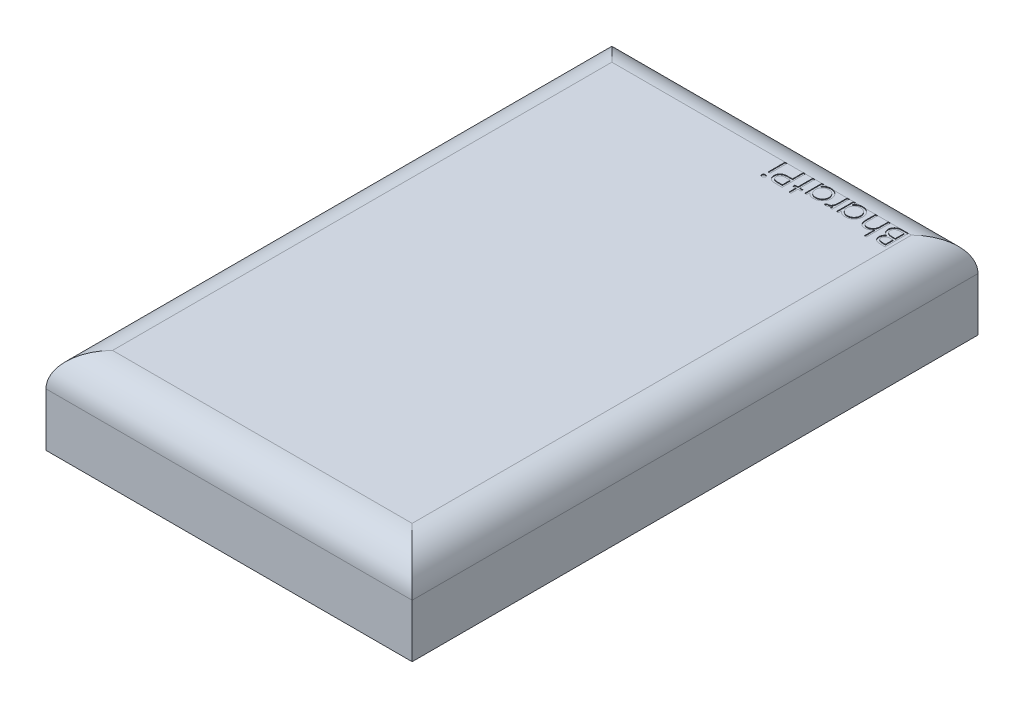
from build123d import *

# Parameters (mm, degrees)
SKETCH1_W           = 55
SKETCH1_H           = 85
BOSS_EXTRUDE1_DEPTH = 13
FILLET1_R           = 5
SKETCH2_W           = 0.314102564
SKETCH2_H           = 2.557692308
CUT_EXTRUDE1_DEPTH  = 0.1


with BuildPart() as part:
    # Sketch1 → Boss-Extrude1 (new body)
    with BuildSketch(Plane(origin=(0, 0, 0), x_dir=(1, 0, 0), z_dir=(0, 1, 0))):
        Rectangle(SKETCH1_W, SKETCH1_H)
    extrude(amount=BOSS_EXTRUDE1_DEPTH)

    # Fillet1
    fillet1_edges = [part.edges().sort_by_distance(p)[0] for p in [
        (-27.5, 13, 0),
        (0, 13, 42.5),
        (27.5, 13, 0),
        (0, 13, -42.5),
    ]]
    fillet(fillet1_edges, radius=FILLET1_R)

    # Sketch2 → Cut-Extrude1 (cut)
    # profile 1 of 9: a face of its own
    with BuildSketch(Plane(origin=(0, 13, 0), x_dir=(1, 0, 0), z_dir=(0, 1, 0))):
        with BuildLine():
            Line((22.051282051, 34), (21.368389423, 34))
            add(Edge.make_bspline(
                [(21.368389423, 34), (21.334960418, 34.000172984), (21.270166686, 34.000508269), (21.175954408, 34.005829002), (21.087680778, 34.012902413), (21.005501786, 34.02476768), (20.928882705, 34.037070397), (20.85860138, 34.05512784), (20.794069117, 34.075072944), (20.716579078, 34.105761192), (20.628656011, 34.153420429), (20.534155165, 34.224103607), (20.452009264, 34.308847029), (20.382160899, 34.405418843), (20.3261061, 34.511658782), (20.286065965, 34.625281059), (20.260342658, 34.744374116), (20.257730433, 34.826023418), (20.256410256, 34.86728766)],
                knots=[0, 0, 0, 0, 1.00128172, 1.940733171, 2.826250472, 3.653024905, 4.427672124, 5.149348099, 5.824709082, 6.450061444, 7.643590664, 8.808605388, 9.972104426, 11.165284501, 12.367876273, 13.557044126, 14.765369432, 16, 16, 16, 16], degree=3))
            add(Edge.make_bspline(
                [(20.256410256, 34.86728766), (20.257488595, 34.905945152), (20.259607633, 34.981910769), (20.280308915, 35.092646797), (20.311556998, 35.198389778), (20.356649879, 35.298120669), (20.414147093, 35.390963139), (20.484101093, 35.475333531), (20.567047364, 35.549575379), (20.629323882, 35.590892023), (20.660957532, 35.611879006)],
                knots=[0, 0, 0, 0, 1.044356178, 2.052258378, 3.035953355, 4.020338374, 5.002448483, 5.980768927, 6.974322109, 8, 8, 8, 8], degree=3))
            add(Edge.make_bspline(
                [(20.660957532, 35.611879006), (20.621194283, 35.627137161), (20.545117337, 35.656329791), (20.440290155, 35.708141918), (20.349943956, 35.764063583), (20.272914422, 35.824504675), (20.208369116, 35.891438768), (20.150869565, 35.963103107), (20.102071463, 36.041993518), (20.060435796, 36.126400483), (20.027453731, 36.215877014), (20.004559592, 36.30975372), (19.990040056, 36.406967318), (19.988141362, 36.473038748), (19.987179487, 36.506510417)],
                knots=[0, 0, 0, 0, 1.272200328, 2.434034374, 3.488177493, 4.442517805, 5.351202203, 6.260825393, 7.183200622, 8.11705787, 9.069326169, 10.026320267, 11.000137371, 12, 12, 12, 12], degree=3))
            add(Edge.make_bspline(
                [(19.987179487, 36.506510417), (19.988156427, 36.540677232), (19.990078583, 36.607901398), (20.004257216, 36.706657345), (20.028271245, 36.801029308), (20.061324283, 36.891645467), (20.104410582, 36.977975111), (20.156463308, 37.060696694), (20.218937559, 37.138584271), (20.28928971, 37.212768085), (20.36778247, 37.280605978), (20.45427535, 37.338903633), (20.546551628, 37.389257714), (20.645874917, 37.429739572), (20.751540451, 37.461429461), (20.863572984, 37.483339798), (20.981908898, 37.498162279), (21.063119828, 37.499377032), (21.104767628, 37.5)],
                knots=[0, 0, 0, 0, 0.978522333, 1.925270105, 2.85076145, 3.763600118, 4.682725947, 5.609499657, 6.557784645, 7.537954401, 8.534920712, 9.522742111, 10.520247711, 11.5409147, 12.58930695, 13.675078472, 14.807699069, 16, 16, 16, 16], degree=3))
            Line((21.104767628, 37.5), (22.051282051, 37.5))
            Line((22.051282051, 37.5), (22.051282051, 34))
        make_face()
        with BuildLine():
            Line((21.737179487, 34.358974359), (21.737179487, 35.480769231))
            Line((21.737179487, 35.480769231), (21.526141827, 35.480769231))
            add(Edge.make_bspline(
                [(21.526141827, 35.480769231), (21.495292754, 35.480372636), (21.435686058, 35.479606334), (21.349136767, 35.477342054), (21.268999446, 35.471279619), (21.194997971, 35.464867583), (21.127628276, 35.454994401), (21.066665012, 35.442912271), (21.011559933, 35.430246421), (20.94804245, 35.408643943), (20.876002732, 35.37705194), (20.799744047, 35.326823143), (20.731107802, 35.268669055), (20.674486862, 35.199689219), (20.627347874, 35.125197235), (20.595611023, 35.044637613), (20.573482911, 34.96078646), (20.571512992, 34.902958368), (20.570512821, 34.873597756)],
                knots=[0, 0, 0, 0, 1.156584208, 2.234756387, 3.244705828, 4.168772894, 5.018724976, 5.795346628, 6.498686023, 7.135894168, 8.308330183, 9.43588092, 10.547699294, 11.667188675, 12.76860303, 13.837480448, 14.902040606, 16, 16, 16, 16], degree=3))
            add(Edge.make_bspline(
                [(20.570512821, 34.873597756), (20.57100062, 34.854160391), (20.571957493, 34.816031875), (20.580978311, 34.760480817), (20.593426932, 34.707618164), (20.613957809, 34.658868998), (20.638281591, 34.612521538), (20.66945887, 34.570039811), (20.705409142, 34.530272982), (20.747322652, 34.494286964), (20.795028068, 34.461739688), (20.850036584, 34.434645635), (20.910852653, 34.41056748), (20.97874448, 34.392315675), (21.052359721, 34.376470202), (21.132821484, 34.366478135), (21.219644851, 34.360059073), (21.279801452, 34.359343995), (21.310897436, 34.358974359)],
                knots=[0, 0, 0, 0, 0.911412742, 1.787835618, 2.63643285, 3.453173233, 4.262886967, 5.08783453, 5.918594724, 6.773969545, 7.67442701, 8.62112486, 9.645634318, 10.739428598, 11.916091468, 13.177237585, 14.540865421, 16, 16, 16, 16], degree=3))
            Line((21.310897436, 34.358974359), (21.737179487, 34.358974359))
        make_face(mode=Mode.SUBTRACT)
        with BuildLine():
            Line((21.737179487, 35.83974359), (21.737179487, 37.141025641))
            Line((21.737179487, 37.141025641), (21.289863782, 37.141025641))
            add(Edge.make_bspline(
                [(21.289863782, 37.141025641), (21.257848057, 37.140604993), (21.196141968, 37.139794251), (21.106981197, 37.13787047), (21.02478179, 37.130733251), (20.948859351, 37.123890525), (20.879565166, 37.112711512), (20.816225231, 37.10188637), (20.760286259, 37.085956638), (20.69483443, 37.064037046), (20.621627218, 37.029006631), (20.541681488, 36.977491407), (20.47126593, 36.914742066), (20.411523263, 36.842489763), (20.361849855, 36.764740239), (20.327485667, 36.681340468), (20.305219629, 36.595076139), (20.302597219, 36.536091755), (20.301282051, 36.506510417)],
                knots=[0, 0, 0, 0, 1.16016216, 2.236059617, 3.229676189, 4.14889023, 4.996733752, 5.772278665, 6.474820656, 7.101410824, 8.271817372, 9.403828207, 10.537358096, 11.673541442, 12.791884111, 13.865947414, 14.929748409, 16, 16, 16, 16], degree=3))
            add(Edge.make_bspline(
                [(20.301282051, 36.506510417), (20.301550517, 36.488014302), (20.302083119, 36.451320418), (20.310455091, 36.397445038), (20.322073246, 36.344998886), (20.339195144, 36.294694354), (20.359907985, 36.245665208), (20.387233498, 36.199506765), (20.418056476, 36.154254134), (20.465796606, 36.096371008), (20.536181938, 36.030484909), (20.636237171, 35.966784366), (20.749367359, 35.914579785), (20.831612726, 35.892510301), (20.874098558, 35.881109776)],
                knots=[0, 0, 0, 0, 0.723354195, 1.435040621, 2.129761981, 2.824182007, 3.512608497, 4.209435533, 4.920062464, 5.654614313, 7.143585817, 8.671381114, 10.280521501, 12, 12, 12, 12], degree=3))
            add(Edge.make_bspline(
                [(20.874098558, 35.881109776), (20.891127638, 35.877654459), (20.928050196, 35.870162621), (20.988258082, 35.862259384), (21.057224435, 35.855169923), (21.134654481, 35.85006353), (21.220856169, 35.844581907), (21.315801805, 35.842525963), (21.419558513, 35.840016576), (21.491550974, 35.839836913), (21.528946314, 35.83974359)],
                knots=[0, 0, 0, 0, 0.634452549, 1.375623993, 2.216454381, 3.166361212, 4.209414599, 5.370755378, 6.634280627, 8, 8, 8, 8], degree=3))
            Line((21.528946314, 35.83974359), (21.737179487, 35.83974359))
        make_face(mode=Mode.SUBTRACT)
    # profile 2 of 9: a face of its own
    with BuildSketch(Plane(origin=(0, 13, 0), x_dir=(1, 0, 0), z_dir=(0, 1, 0))):
        with BuildLine():
            Line((19.358974359, 33.91025641), (19.044871795, 33.91025641))
            Line((19.044871795, 33.91025641), (19.044871795, 35.425380609))
            add(Edge.make_bspline(
                [(19.044871795, 35.425380609), (19.011100806, 35.383295228), (18.945451296, 35.301482855), (18.835705424, 35.193583739), (18.721349423, 35.101679352), (18.601412826, 35.026630609), (18.476405369, 34.968411013), (18.346019877, 34.92768025), (18.210588758, 34.90228145), (18.118333258, 34.899062498), (18.071714744, 34.897435897)],
                knots=[0, 0, 0, 0, 1.12556596, 2.18805719, 3.205172764, 4.182516927, 5.13416184, 6.075333115, 7.027428072, 8, 8, 8, 8], degree=3))
            add(Edge.make_bspline(
                [(18.071714744, 34.897435897), (18.024361523, 34.899082507), (17.931633388, 34.902306936), (17.797107583, 34.930718234), (17.670585355, 34.975679603), (17.553756791, 35.038869491), (17.448425874, 35.117327732), (17.35706834, 35.209345734), (17.280429488, 35.313711535), (17.229152417, 35.410992645), (17.195545328, 35.497503689), (17.174301412, 35.571746709), (17.156279797, 35.654466634), (17.140580803, 35.745631977), (17.130116996, 35.845676962), (17.121712445, 35.954151272), (17.115735971, 36.071048374), (17.11550437, 36.151968626), (17.115384615, 36.193810096)],
                knots=[0, 0, 0, 0, 1.235689485, 2.419754739, 3.574485241, 4.732583367, 5.875375667, 6.993392835, 8.106934443, 9.24564317, 9.854426656, 10.528623913, 11.260290605, 12.06517837, 12.94359002, 13.886555271, 14.907200199, 16, 16, 16, 16], degree=3))
            Line((17.115384615, 36.193810096), (17.115384615, 37.5))
            Line((17.115384615, 37.5), (17.429487179, 37.5))
            Line((17.429487179, 37.5), (17.429487179, 36.296875))
            add(Edge.make_bspline(
                [(17.429487179, 36.296875), (17.429676722, 36.262052286), (17.430039284, 36.19544236), (17.431252502, 36.100076832), (17.43389919, 36.013812076), (17.43833423, 35.936469018), (17.442796917, 35.868152476), (17.449123843, 35.808750862), (17.456430132, 35.758636821), (17.462999336, 35.728472221), (17.465945513, 35.71494391)],
                knots=[0, 0, 0, 0, 1.430934443, 2.737134061, 3.918973087, 4.976914145, 5.92044225, 6.731742364, 7.431207999, 8, 8, 8, 8], degree=3))
            add(Edge.make_bspline(
                [(17.465945513, 35.71494391), (17.47731672, 35.675220507), (17.499120044, 35.59905425), (17.550810245, 35.495777861), (17.613868602, 35.406925297), (17.692028761, 35.335020237), (17.782694211, 35.278363459), (17.886725701, 35.239763165), (18.002793898, 35.215147337), (18.084432465, 35.212777257), (18.127103365, 35.211538462)],
                knots=[0, 0, 0, 0, 1.090171874, 2.090312098, 3.036871164, 3.954896932, 4.878889889, 5.844924892, 6.87358393, 8, 8, 8, 8], degree=3))
            add(Edge.make_bspline(
                [(18.127103365, 35.211538462), (18.152373385, 35.212007439), (18.202382101, 35.212935532), (18.27649801, 35.222489301), (18.348617161, 35.23757819), (18.418545988, 35.259865822), (18.486427137, 35.28696337), (18.552536538, 35.320217481), (18.615969442, 35.360425281), (18.677544584, 35.40567876), (18.734864987, 35.455741071), (18.78819136, 35.508589954), (18.835729894, 35.564864414), (18.878798434, 35.623664663), (18.915976733, 35.685796421), (18.948429811, 35.750660749), (18.975965509, 35.818342892), (18.989648201, 35.865317954), (18.996494391, 35.888822115)],
                knots=[0, 0, 0, 0, 1.024369801, 2.02720137, 3.025498567, 4.008789058, 4.999724648, 5.987391013, 7.005161842, 8.042127274, 9.083588116, 10.088924978, 11.084112559, 12.068088063, 13.041783903, 14.016724555, 15.007660144, 16, 16, 16, 16], degree=3))
            add(Edge.make_bspline(
                [(18.996494391, 35.888822115), (19.000433818, 35.905843066), (19.009018315, 35.942933813), (19.018333148, 36.004108137), (19.026670945, 36.075194509), (19.033719495, 36.15608511), (19.038042581, 36.247076352), (19.042700822, 36.347547311), (19.044434836, 36.458127332), (19.044721789, 36.535022839), (19.044871795, 36.575220353)],
                knots=[0, 0, 0, 0, 0.607992626, 1.324890765, 2.152360218, 3.099583803, 4.150613268, 5.323148443, 6.60066238, 8, 8, 8, 8], degree=3))
            Line((19.044871795, 36.575220353), (19.044871795, 37.5))
            Line((19.044871795, 37.5), (19.358974359, 37.5))
            Line((19.358974359, 37.5), (19.358974359, 33.91025641))
        make_face()
    # profile 3 of 9: a face of its own
    with BuildSketch(Plane(origin=(0, 13, 0), x_dir=(1, 0, 0), z_dir=(0, 1, 0))):
        with BuildLine():
            Line((13.794871795, 34.942307692), (13.794871795, 37.5))
            Line((13.794871795, 37.5), (14.108974359, 37.5))
            Line((14.108974359, 37.5), (14.108974359, 37.057592147))
            add(Edge.make_bspline(
                [(14.108974359, 37.057592147), (14.144441134, 37.097576535), (14.21375792, 37.175722609), (14.328421015, 37.278443761), (14.450967955, 37.362310526), (14.579310924, 37.430385343), (14.714443339, 37.481701428), (14.855571575, 37.517852974), (15.002585209, 37.541370069), (15.10284054, 37.543694081), (15.153645833, 37.544871795)],
                knots=[0, 0, 0, 0, 1.074235403, 2.099501444, 3.086304576, 4.053325556, 5.01427503, 5.985443889, 6.979105517, 8, 8, 8, 8], degree=3))
            add(Edge.make_bspline(
                [(15.153645833, 37.544871795), (15.19881391, 37.543645626), (15.287887357, 37.541227567), (15.418914669, 37.522462337), (15.545013436, 37.492342521), (15.666264022, 37.450401861), (15.781844855, 37.39505608), (15.892407204, 37.328080041), (15.9982091, 37.24910346), (16.097238413, 37.158464824), (16.188545893, 37.060122499), (16.268430717, 36.954926059), (16.336135705, 36.844320376), (16.39177708, 36.728336536), (16.434835294, 36.607059323), (16.46479216, 36.480571936), (16.483537168, 36.349084842), (16.485954002, 36.259544937), (16.487179487, 36.214142628)],
                knots=[0, 0, 0, 0, 1.034036272, 2.039165313, 3.024406509, 3.999331371, 4.971254918, 5.953351348, 6.95522652, 7.989525907, 9.023492927, 10.024309745, 11.009187477, 11.988246066, 12.964946762, 13.950187958, 14.960617622, 16, 16, 16, 16], degree=3))
            add(Edge.make_bspline(
                [(16.487179487, 36.214142628), (16.485926821, 36.169678735), (16.483450368, 36.081776017), (16.464992737, 35.952500058), (16.433978011, 35.827971686), (16.390369842, 35.708652201), (16.334698879, 35.594061063), (16.265829518, 35.485094836), (16.185973481, 35.380086643), (16.093690154, 35.28240391), (15.993772017, 35.192500637), (15.88737817, 35.113332127), (15.775835238, 35.046527808), (15.658919561, 34.992222391), (15.537459007, 34.949068002), (15.410530904, 34.918985237), (15.278712469, 34.901301387), (15.189222918, 34.898736774), (15.143830128, 34.897435897)],
                knots=[0, 0, 0, 0, 1.02050356, 2.017480486, 2.990790918, 3.96161403, 4.928589988, 5.909588639, 6.91611943, 7.952353252, 8.989586576, 9.99823133, 10.991940466, 11.968822692, 12.952985106, 13.945868367, 14.958059758, 16, 16, 16, 16], degree=3))
            add(Edge.make_bspline(
                [(15.143830128, 34.897435897), (15.091629228, 34.898868251), (14.989265725, 34.901677028), (14.839329316, 34.925251159), (14.697422446, 34.964709238), (14.562315982, 35.018565451), (14.435908605, 35.091090603), (14.31698511, 35.180828566), (14.206956568, 35.289954882), (14.142200082, 35.372970602), (14.108974359, 35.415564904)],
                knots=[0, 0, 0, 0, 1.038908319, 2.037250181, 3.012632028, 3.966567879, 4.9252131, 5.905168122, 6.925168603, 8, 8, 8, 8], degree=3))
            Line((14.108974359, 35.415564904), (14.108974359, 34.942307692))
            Line((14.108974359, 34.942307692), (13.794871795, 34.942307692))
        make_face()
        with BuildLine():
            add(Edge.make_bspline(
                [(15.139623397, 35.211538462), (15.185536775, 35.21317348), (15.276162479, 35.216400746), (15.409220371, 35.241554277), (15.53648159, 35.283513891), (15.657739186, 35.340567823), (15.769645456, 35.413652149), (15.871317506, 35.499824237), (15.959999181, 35.600139859), (16.034982032, 35.712294248), (16.097231696, 35.831808374), (16.140188798, 35.957653128), (16.1687211, 36.08642718), (16.171621202, 36.173793995), (16.173076923, 36.217648237)],
                knots=[0, 0, 0, 0, 1.031179624, 2.035384561, 3.030098214, 4.035455833, 5.037557836, 6.024646278, 7.02156144, 8.035264006, 9.049836703, 10.039645228, 11.015989397, 12, 12, 12, 12], degree=3))
            add(Edge.make_bspline(
                [(16.173076923, 36.217648237), (16.171187217, 36.261229683), (16.167415212, 36.348221751), (16.141065352, 36.477193145), (16.094813711, 36.60221686), (16.033925733, 36.72327158), (15.957762555, 36.836262519), (15.869255912, 36.938430416), (15.767067957, 37.025930843), (15.654176284, 37.099221738), (15.533729888, 37.158178374), (15.407021183, 37.199760676), (15.276258663, 37.226015378), (15.187188202, 37.229179283), (15.142427885, 37.230769231)],
                knots=[0, 0, 0, 0, 0.979235476, 1.954632679, 2.943119654, 3.967171814, 4.992637064, 5.997548408, 6.995574264, 8.005058949, 9.015076297, 9.999929117, 10.994910263, 12, 12, 12, 12], degree=3))
            add(Edge.make_bspline(
                [(15.142427885, 37.230769231), (15.096982105, 37.229115056), (15.006824838, 37.225833434), (14.87330687, 37.200506432), (14.743974486, 37.15802581), (14.619880953, 37.10017975), (14.504473715, 37.028464705), (14.401375967, 36.944134227), (14.312309429, 36.847560067), (14.238977813, 36.739319282), (14.180386842, 36.621963885), (14.138899991, 36.496616927), (14.113702338, 36.364023263), (14.110572143, 36.273148935), (14.108974359, 36.226762821)],
                knots=[0, 0, 0, 0, 1.017730373, 2.019016736, 3.032373701, 4.060729657, 5.079187105, 6.068726676, 7.03591854, 8.011858086, 8.988317194, 9.965225429, 10.961364673, 12, 12, 12, 12], degree=3))
            add(Edge.make_bspline(
                [(14.108974359, 36.226762821), (14.109934031, 36.191425004), (14.111822968, 36.121868997), (14.126253321, 36.019741285), (14.14920904, 35.922008272), (14.181552323, 35.828562987), (14.224054343, 35.739937624), (14.275261648, 35.655437485), (14.336224576, 35.575849676), (14.40508787, 35.501274987), (14.4813149, 35.433595644), (14.562372468, 35.373943638), (14.648056633, 35.323461627), (14.738307249, 35.283062813), (14.8324292, 35.250150913), (14.931324628, 35.228413172), (15.033996847, 35.213439223), (15.104043835, 35.21217872), (15.139623397, 35.211538462)],
                knots=[0, 0, 0, 0, 1.050062701, 2.066855696, 3.059271411, 4.030305351, 4.999747758, 5.975466543, 6.961907836, 7.974539719, 8.98812422, 9.98710676, 10.961662635, 11.93785114, 12.922015094, 13.919620009, 14.94329489, 16, 16, 16, 16], degree=3))
        make_face(mode=Mode.SUBTRACT)
    # profile 4 of 9: a face of its own
    with BuildSketch(Plane(origin=(0, 13, 0), x_dir=(1, 0, 0), z_dir=(0, 1, 0))):
        with BuildLine():
            Line((13.166666667, 34.942307692), (12.852564103, 34.942307692))
            Line((12.852564103, 34.942307692), (12.852564103, 35.318810096))
            add(Edge.make_bspline(
                [(12.852564103, 35.318810096), (12.829392961, 35.283734911), (12.785078334, 35.216653893), (12.711032389, 35.128110867), (12.636019001, 35.053633499), (12.557486281, 34.995704945), (12.477431342, 34.951561399), (12.396091008, 34.92027648), (12.31287827, 34.901207266), (12.256707541, 34.898694704), (12.228565705, 34.897435897)],
                knots=[0, 0, 0, 0, 1.280240866, 2.448450709, 3.511242029, 4.49418232, 5.41222037, 6.289222348, 7.142891256, 8, 8, 8, 8], degree=3))
            add(Edge.make_bspline(
                [(12.228565705, 34.897435897), (12.206732307, 34.89859979), (12.162036073, 34.900982453), (12.094169958, 34.918560852), (12.023958744, 34.945560824), (11.978650047, 34.97157234), (11.955128205, 34.985076122)],
                knots=[0, 0, 0, 0, 0.90119973, 1.844890732, 2.881183062, 4, 4, 4, 4], degree=3))
            Line((11.955128205, 34.985076122), (12.127604167, 35.257111378))
            add(Edge.make_bspline(
                [(12.127604167, 35.257111378), (12.142713188, 35.250371112), (12.171393002, 35.237576797), (12.213347569, 35.222434787), (12.252028905, 35.213518871), (12.276672464, 35.212168153), (12.288161058, 35.211538462)],
                knots=[0, 0, 0, 0, 1.180555205, 2.24091978, 3.179933427, 4, 4, 4, 4], degree=3))
            add(Edge.make_bspline(
                [(12.288161058, 35.211538462), (12.313627648, 35.213143427), (12.365108147, 35.216387851), (12.440328419, 35.24410812), (12.514296002, 35.285769922), (12.571741098, 35.334913432), (12.616716674, 35.381220018), (12.649082538, 35.421969567), (12.678150705, 35.46805415), (12.70634171, 35.517728177), (12.732534926, 35.57222795), (12.755941949, 35.631645363), (12.777832161, 35.695488907), (12.790159697, 35.739880847), (12.796474359, 35.762620192)],
                knots=[0, 0, 0, 0, 1.1355652, 2.295535532, 3.545064593, 4.917862323, 5.656949634, 6.430545574, 7.239270929, 8.090880714, 8.983622437, 9.940313733, 10.94494545, 12, 12, 12, 12], degree=3))
            add(Edge.make_bspline(
                [(12.796474359, 35.762620192), (12.801214931, 35.782896243), (12.811767593, 35.828031366), (12.821753985, 35.903408766), (12.832018369, 35.992407393), (12.839027909, 36.095130637), (12.845649355, 36.211973369), (12.849307315, 36.342431528), (12.852447719, 36.486863682), (12.85252407, 36.587604542), (12.852564103, 36.640424679)],
                knots=[0, 0, 0, 0, 0.566841273, 1.261806378, 2.068780918, 3.007109044, 4.065315289, 5.256255371, 6.561408263, 8, 8, 8, 8], degree=3))
            Line((12.852564103, 36.640424679), (12.852564103, 37.5))
            Line((12.852564103, 37.5), (13.166666667, 37.5))
            Line((13.166666667, 37.5), (13.166666667, 34.942307692))
        make_face()
    # profile 5 of 9: a face of its own
    with BuildSketch(Plane(origin=(0, 13, 0), x_dir=(1, 0, 0), z_dir=(0, 1, 0))):
        with BuildLine():
            Line((9.038461538, 34.942307692), (9.038461538, 37.5))
            Line((9.038461538, 37.5), (9.352564103, 37.5))
            Line((9.352564103, 37.5), (9.352564103, 37.057592147))
            add(Edge.make_bspline(
                [(9.352564103, 37.057592147), (9.388030878, 37.097576535), (9.457347664, 37.175722609), (9.572010759, 37.278443761), (9.694557699, 37.362310526), (9.822900667, 37.430385343), (9.958033083, 37.481701428), (10.099161319, 37.517852974), (10.246174953, 37.541370069), (10.346430284, 37.543694081), (10.397235577, 37.544871795)],
                knots=[0, 0, 0, 0, 1.074235403, 2.099501444, 3.086304576, 4.053325556, 5.01427503, 5.985443889, 6.979105517, 8, 8, 8, 8], degree=3))
            add(Edge.make_bspline(
                [(10.397235577, 37.544871795), (10.442403654, 37.543645626), (10.5314771, 37.541227567), (10.662504413, 37.522462337), (10.788603179, 37.492342521), (10.909853765, 37.450401861), (11.025434599, 37.39505608), (11.135996947, 37.328080041), (11.241798843, 37.24910346), (11.340828156, 37.158464824), (11.432135637, 37.060122499), (11.51202046, 36.954926059), (11.579725449, 36.844320376), (11.635366824, 36.728336536), (11.678425037, 36.607059323), (11.708381903, 36.480571936), (11.727126911, 36.349084842), (11.729543745, 36.259544937), (11.730769231, 36.214142628)],
                knots=[0, 0, 0, 0, 1.034036272, 2.039165313, 3.024406509, 3.999331371, 4.971254918, 5.953351348, 6.95522652, 7.989525907, 9.023492927, 10.024309745, 11.009187477, 11.988246066, 12.964946762, 13.950187958, 14.960617622, 16, 16, 16, 16], degree=3))
            add(Edge.make_bspline(
                [(11.730769231, 36.214142628), (11.729516565, 36.169678735), (11.727040111, 36.081776017), (11.708582481, 35.952500058), (11.677567755, 35.827971686), (11.633959586, 35.708652201), (11.578288623, 35.594061063), (11.509419261, 35.485094836), (11.429563225, 35.380086643), (11.337279898, 35.28240391), (11.237361761, 35.192500637), (11.130967914, 35.113332127), (11.019424981, 35.046527808), (10.902509305, 34.992222391), (10.781048751, 34.949068002), (10.654120647, 34.918985237), (10.522302213, 34.901301387), (10.432812661, 34.898736774), (10.387419872, 34.897435897)],
                knots=[0, 0, 0, 0, 1.02050356, 2.017480486, 2.990790918, 3.96161403, 4.928589988, 5.909588639, 6.91611943, 7.952353252, 8.989586576, 9.99823133, 10.991940466, 11.968822692, 12.952985106, 13.945868367, 14.958059758, 16, 16, 16, 16], degree=3))
            add(Edge.make_bspline(
                [(10.387419872, 34.897435897), (10.335218971, 34.898868251), (10.232855469, 34.901677028), (10.08291906, 34.925251159), (9.94101219, 34.964709238), (9.805905725, 35.018565451), (9.679498348, 35.091090603), (9.560574854, 35.180828566), (9.450546311, 35.289954882), (9.385789826, 35.372970602), (9.352564103, 35.415564904)],
                knots=[0, 0, 0, 0, 1.038908319, 2.037250181, 3.012632028, 3.966567879, 4.9252131, 5.905168122, 6.925168603, 8, 8, 8, 8], degree=3))
            Line((9.352564103, 35.415564904), (9.352564103, 34.942307692))
            Line((9.352564103, 34.942307692), (9.038461538, 34.942307692))
        make_face()
        with BuildLine():
            add(Edge.make_bspline(
                [(10.383213141, 35.211538462), (10.429126518, 35.21317348), (10.519752223, 35.216400746), (10.652810115, 35.241554277), (10.780071334, 35.283513891), (10.90132893, 35.340567823), (11.0132352, 35.413652149), (11.11490725, 35.499824237), (11.203588925, 35.600139859), (11.278571776, 35.712294248), (11.340821439, 35.831808374), (11.383778542, 35.957653128), (11.412310844, 36.08642718), (11.415210945, 36.173793995), (11.416666667, 36.217648237)],
                knots=[0, 0, 0, 0, 1.031179624, 2.035384561, 3.030098214, 4.035455833, 5.037557836, 6.024646278, 7.02156144, 8.035264006, 9.049836703, 10.039645228, 11.015989397, 12, 12, 12, 12], degree=3))
            add(Edge.make_bspline(
                [(11.416666667, 36.217648237), (11.414776961, 36.261229683), (11.411004956, 36.348221751), (11.384655096, 36.477193145), (11.338403455, 36.60221686), (11.277515476, 36.72327158), (11.201352298, 36.836262519), (11.112845655, 36.938430416), (11.010657701, 37.025930843), (10.897766028, 37.099221738), (10.777319631, 37.158178374), (10.650610927, 37.199760676), (10.519848407, 37.226015378), (10.430777945, 37.229179283), (10.386017628, 37.230769231)],
                knots=[0, 0, 0, 0, 0.979235476, 1.954632679, 2.943119654, 3.967171814, 4.992637064, 5.997548408, 6.995574264, 8.005058949, 9.015076297, 9.999929117, 10.994910263, 12, 12, 12, 12], degree=3))
            add(Edge.make_bspline(
                [(10.386017628, 37.230769231), (10.340571849, 37.229115056), (10.250414582, 37.225833434), (10.116896613, 37.200506432), (9.98756423, 37.15802581), (9.863470697, 37.10017975), (9.748063459, 37.028464705), (9.644965711, 36.944134227), (9.555899172, 36.847560067), (9.482567556, 36.739319282), (9.423976586, 36.621963885), (9.382489734, 36.496616927), (9.357292082, 36.364023263), (9.354161887, 36.273148935), (9.352564103, 36.226762821)],
                knots=[0, 0, 0, 0, 1.017730373, 2.019016736, 3.032373701, 4.060729657, 5.079187105, 6.068726676, 7.03591854, 8.011858086, 8.988317194, 9.965225429, 10.961364673, 12, 12, 12, 12], degree=3))
            add(Edge.make_bspline(
                [(9.352564103, 36.226762821), (9.353523774, 36.191425004), (9.355412711, 36.121868997), (9.369843064, 36.019741285), (9.392798784, 35.922008272), (9.425142067, 35.828562987), (9.467644087, 35.739937624), (9.518851392, 35.655437485), (9.57981432, 35.575849676), (9.648677613, 35.501274987), (9.724904644, 35.433595644), (9.805962211, 35.373943638), (9.891646376, 35.323461627), (9.981896993, 35.283062813), (10.076018944, 35.250150913), (10.174914372, 35.228413172), (10.277586591, 35.213439223), (10.347633579, 35.21217872), (10.383213141, 35.211538462)],
                knots=[0, 0, 0, 0, 1.050062701, 2.066855696, 3.059271411, 4.030305351, 4.999747758, 5.975466543, 6.961907836, 7.974539719, 8.98812422, 9.98710676, 10.961662635, 11.93785114, 12.922015094, 13.919620009, 14.94329489, 16, 16, 16, 16], degree=3))
        make_face(mode=Mode.SUBTRACT)
    # profile 6 of 9: a face of its own
    with BuildSketch(Plane(origin=(0, 13, 0), x_dir=(1, 0, 0), z_dir=(0, 1, 0))):
        Polygon((8.006410256, 33.91025641), (7.692307692, 33.91025641), (7.692307692, 34.942307692), (7.243589744, 34.942307692), (7.243589744, 35.256410256), (7.692307692, 35.256410256), (7.692307692, 37.5), (8.006410256, 37.5), (8.006410256, 35.256410256), (8.455128205, 35.256410256), (8.455128205, 34.942307692), (8.006410256, 34.942307692), align=None)
    # profile 7 of 9: a face of its own
    with BuildSketch(Plane(origin=(0, 13, 0), x_dir=(1, 0, 0), z_dir=(0, 1, 0))):
        with BuildLine():
            Line((6.570512821, 34), (5.884114583, 34))
            add(Edge.make_bspline(
                [(5.884114583, 34), (5.836903677, 34.000051896), (5.746445484, 34.000151332), (5.616730429, 34.003166078), (5.498920697, 34.00719277), (5.393270316, 34.012774663), (5.299454218, 34.019371253), (5.217896918, 34.028623292), (5.147957362, 34.038283588), (5.106050913, 34.048104995), (5.086939103, 34.052584135)],
                knots=[0, 0, 0, 0, 1.415646017, 2.712440637, 3.8905458, 4.950247383, 5.884950622, 6.709939814, 7.411656543, 8, 8, 8, 8], degree=3))
            add(Edge.make_bspline(
                [(5.086939103, 34.052584135), (5.062745722, 34.059206284), (5.014929049, 34.072294541), (4.946025782, 34.098505373), (4.880480193, 34.12959827), (4.81801811, 34.164982536), (4.759709581, 34.206329182), (4.703734099, 34.251251821), (4.651265553, 34.301567231), (4.6030962, 34.357209166), (4.558465215, 34.416354819), (4.521105882, 34.480512373), (4.48811612, 34.547456175), (4.462406898, 34.61882068), (4.442198462, 34.693663885), (4.427480637, 34.772180583), (4.418021176, 34.854201396), (4.417123592, 34.910263192), (4.416666667, 34.938802083)],
                knots=[0, 0, 0, 0, 0.999333726, 1.975119402, 2.933498163, 3.889020618, 4.832249799, 5.779334906, 6.747801194, 7.724875447, 8.710438469, 9.696133548, 10.679360639, 11.681339199, 12.714023775, 13.766351759, 14.862936069, 16, 16, 16, 16], degree=3))
            add(Edge.make_bspline(
                [(4.416666667, 34.938802083), (4.417088091, 34.96757986), (4.417912637, 35.023885524), (4.427808923, 35.106258312), (4.441139114, 35.184976702), (4.461636167, 35.259866153), (4.48848184, 35.330481923), (4.519973893, 35.397903155), (4.557957423, 35.460982827), (4.601602253, 35.519949945), (4.650153847, 35.574859857), (4.703406785, 35.625314652), (4.761146078, 35.67101899), (4.823188226, 35.712075334), (4.890138075, 35.747531613), (4.960980228, 35.779288918), (5.036330445, 35.805959979), (5.088472959, 35.81999004), (5.114983974, 35.827123397)],
                knots=[0, 0, 0, 0, 1.121902311, 2.195077645, 3.232258892, 4.234102512, 5.217864754, 6.176164875, 7.132989551, 8.084763148, 9.034132444, 9.988522005, 10.94243251, 11.903244335, 12.886203696, 13.894208494, 14.929344452, 16, 16, 16, 16], degree=3))
            add(Edge.make_bspline(
                [(5.114983974, 35.827123397), (5.136911558, 35.831782903), (5.184967133, 35.841994481), (5.264104892, 35.853472009), (5.356291515, 35.862884836), (5.46121334, 35.871668962), (5.579115043, 35.87632345), (5.709726214, 35.881788578), (5.853488885, 35.884367274), (5.953758867, 35.884530279), (6.006109776, 35.884615385)],
                knots=[0, 0, 0, 0, 0.601372724, 1.317943291, 2.144091499, 3.08771165, 4.142394186, 5.309582461, 6.595334295, 8, 8, 8, 8], degree=3))
            Line((6.006109776, 35.884615385), (6.256410256, 35.884615385))
            Line((6.256410256, 35.884615385), (6.256410256, 37.5))
            Line((6.256410256, 37.5), (6.570512821, 37.5))
            Line((6.570512821, 37.5), (6.570512821, 34))
        make_face()
        with BuildLine():
            Line((6.256410256, 34.358974359), (6.256410256, 35.525641026))
            Line((6.256410256, 35.525641026), (5.643629808, 35.533353365))
            add(Edge.make_bspline(
                [(5.643629808, 35.533353365), (5.613709378, 35.533373094), (5.555948606, 35.53341118), (5.472286107, 35.529357619), (5.394853476, 35.524947802), (5.323536387, 35.517816081), (5.258660351, 35.509117604), (5.200068294, 35.497487697), (5.147292623, 35.485625943), (5.086500895, 35.465043694), (5.018407783, 35.43399276), (4.944502643, 35.387614319), (4.881356762, 35.329189145), (4.827174562, 35.262788329), (4.784347234, 35.188842406), (4.753308413, 35.109944244), (4.734362961, 35.026393429), (4.731981678, 34.969282685), (4.730769231, 34.940204327)],
                knots=[0, 0, 0, 0, 1.160501667, 2.240324542, 3.248665471, 4.168823117, 5.020172044, 5.786515869, 6.485785279, 7.116517804, 8.272762037, 9.381837012, 10.485674779, 11.594342068, 12.695271952, 13.786226926, 14.872841088, 16, 16, 16, 16], degree=3))
            add(Edge.make_bspline(
                [(4.730769231, 34.940204327), (4.732035771, 34.912068028), (4.734553495, 34.856136547), (4.753151917, 34.774125119), (4.784675945, 34.696123905), (4.827209477, 34.622764074), (4.880093281, 34.556539741), (4.941983322, 34.49941665), (5.011916687, 34.453182197), (5.076462276, 34.422404362), (5.134225495, 34.404355554), (5.184156544, 34.391325229), (5.240820647, 34.38233849), (5.30368155, 34.373739872), (5.372658769, 34.366798916), (5.448190915, 34.361978894), (5.530026396, 34.359187578), (5.5868367, 34.359047153), (5.616286058, 34.358974359)],
                knots=[0, 0, 0, 0, 1.12039168, 2.227199994, 3.330242575, 4.460839274, 5.593542475, 6.693949254, 7.801736126, 8.92216649, 9.528704869, 10.210659466, 10.975987387, 11.81211542, 12.738540127, 13.736887663, 14.826846554, 16, 16, 16, 16], degree=3))
            Line((5.616286058, 34.358974359), (6.256410256, 34.358974359))
        make_face(mode=Mode.SUBTRACT)
    # profile 8 of 9: a face of its own
    with BuildSketch(Plane(origin=(0, 13, 0), x_dir=(1, 0, 0), z_dir=(0, 1, 0))):
        with BuildLine():
            add(Edge.make_bspline(
                [(3.677684295, 33.865384615), (3.658196233, 33.86629269), (3.620034866, 33.868070874), (3.564795373, 33.883176643), (3.514546577, 33.909172417), (3.469311985, 33.942915564), (3.431814589, 33.984230683), (3.404926959, 34.03117379), (3.387761979, 34.08227867), (3.385676966, 34.117887461), (3.384615385, 34.136017628)],
                knots=[0, 0, 0, 0, 1.054986045, 2.065865298, 3.074122704, 4.105114675, 5.109626121, 6.074217918, 7.019490725, 8, 8, 8, 8], degree=3))
            add(Edge.make_bspline(
                [(3.384615385, 34.136017628), (3.385700714, 34.153677192), (3.387846283, 34.188588061), (3.404914271, 34.238806847), (3.43204001, 34.285096281), (3.469287027, 34.326330626), (3.514553168, 34.36005428), (3.564793629, 34.386055203), (3.620035325, 34.401159612), (3.658196389, 34.402937984), (3.677684295, 34.403846154)],
                knots=[0, 0, 0, 0, 0.961106377, 1.899993565, 2.859409042, 3.870007927, 4.90724781, 5.921615355, 6.938620636, 8, 8, 8, 8], degree=3))
            add(Edge.make_bspline(
                [(3.677684295, 34.403846154), (3.696948378, 34.402967151), (3.734443399, 34.401256287), (3.788667201, 34.385874492), (3.838107476, 34.360110821), (3.882602312, 34.325863936), (3.920587806, 34.285370463), (3.947613458, 34.238771881), (3.96472708, 34.188596963), (3.966866499, 34.153680183), (3.967948718, 34.136017628)],
                knots=[0, 0, 0, 0, 1.055304112, 2.054011575, 3.063363921, 4.096942562, 5.122536081, 6.088009498, 7.032825006, 8, 8, 8, 8], degree=3))
            add(Edge.make_bspline(
                [(3.967948718, 34.136017628), (3.966890363, 34.117884357), (3.964811687, 34.082269469), (3.947600176, 34.031209353), (3.920816007, 33.983954162), (3.882577769, 33.943381916), (3.838113902, 33.909116), (3.788665528, 33.883357305), (3.734443843, 33.86797421), (3.696948529, 33.866263526), (3.677684295, 33.865384615)],
                knots=[0, 0, 0, 0, 0.986662878, 1.937868148, 2.908513651, 3.927890639, 4.955204348, 5.958438607, 6.951092507, 8, 8, 8, 8], degree=3))
        make_face()
    # profile 9 of 9: a face of its own
    with BuildSketch(Plane(origin=(0, 13, 0), x_dir=(1, 0, 0), z_dir=(0, 1, 0))):
        with Locations((3.676282051, 36.221153846)):
            Rectangle(SKETCH2_W, SKETCH2_H)
    extrude(amount=-CUT_EXTRUDE1_DEPTH, mode=Mode.SUBTRACT)


solid = part.part
